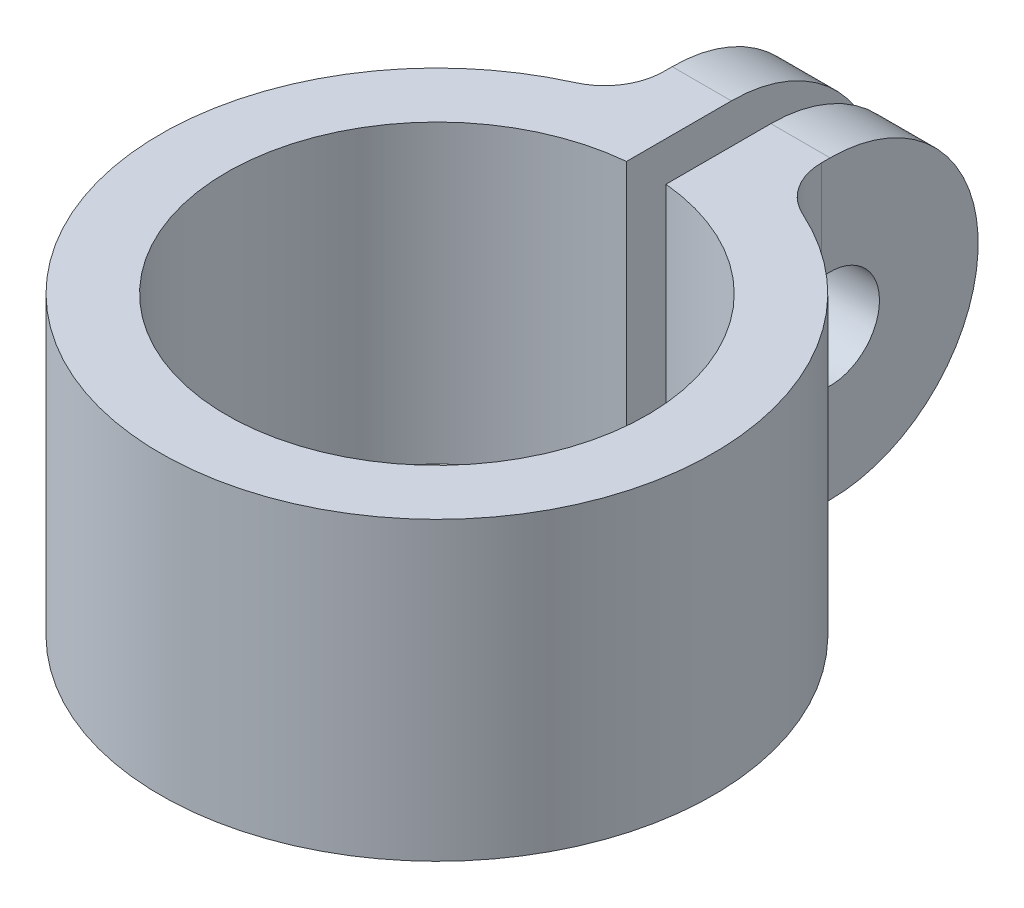
from build123d import *

# Parameters (mm, degrees)
BOSS_EXTRUDE1_DEPTH = 15
FILLET1_RADIUS      = 7.5
FILLET1_LENGTH      = 3
FILLET2_RADIUS      = 7.5
FILLET2_LENGTH      = 3
CUT_EXTRUDE1_REACH  = 35.126
SKETCH2_R           = 2.5


with BuildPart() as part:
    # Sketch1 → Boss-Extrude1 (new body)
    with BuildSketch(Plane(origin=(0, 0, 0), x_dir=(1, 0, 0), z_dir=(0, 1, 0))):
        with BuildLine():
            Line((1, 10.602947703), (1, 23.416407865))
            Line((1, 23.416407865), (4, 23.416407865))
            Line((4, 23.416407865), (4, 15.491933385))
            ThreePointArc((4, 15.491933385), (4.479495849, 13.864954951), (5.764705882, 12.758062788))
            ThreePointArc((5.764705882, 12.758062788), (0, -14), (-5.764705882, 12.758062788))
            ThreePointArc((-5.764705882, 12.758062788), (-4.479495849, 13.864954951), (-4, 15.491933385))
            Line((-4, 15.491933385), (-4, 23.416407865))
            Line((-4, 23.416407865), (-1, 23.416407865))
            Line((-1, 23.416407865), (-1, 10.602947703))
            ThreePointArc((-1, 10.602947703), (0, -10.65), (1, 10.602947703))
        make_face()
    extrude(amount=BOSS_EXTRUDE1_DEPTH)

    # Fillet1: full round fillet: the end face becomes a half cylinder, R = half its width
    fillet1_face = Plane((-2.5, 7.5, -23.416407865), x_dir=(-1, 0, 0), z_dir=(0, 0, -1))  # on the end face: x along it, z out of the body
    fillet1_slab = fillet1_face.offset(-FILLET1_RADIUS / 2) * Box(FILLET1_LENGTH, 2 * FILLET1_RADIUS, FILLET1_RADIUS, mode=Mode.PRIVATE)  # the body's end, R deep
    fillet1_round = Plane((-2.5, 7.5, -15.916407865), x_dir=(0, 0, -1), z_dir=(-1, 0, 0)) * Cylinder(FILLET1_RADIUS, FILLET1_LENGTH, mode=Mode.PRIVATE)  # its axis R under the face
    add(fillet1_slab - fillet1_round, mode=Mode.SUBTRACT)

    # Fillet2: full round fillet: the end face becomes a half cylinder, R = half its width
    fillet2_face = Plane((2.5, 7.5, -23.416407865), x_dir=(1, 0, 0), z_dir=(0, 0, -1))  # on the end face: x along it, z out of the body
    fillet2_slab = fillet2_face.offset(-FILLET2_RADIUS / 2) * Box(FILLET2_LENGTH, 2 * FILLET2_RADIUS, FILLET2_RADIUS, mode=Mode.PRIVATE)  # the body's end, R deep
    fillet2_round = Plane((2.5, 7.5, -15.916407865), x_dir=(0, 0, -1), z_dir=(1, 0, 0)) * Cylinder(FILLET2_RADIUS, FILLET2_LENGTH, mode=Mode.PRIVATE)  # its axis R under the face
    add(fillet2_slab - fillet2_round, mode=Mode.SUBTRACT)

    # Cut-Extrude1: up to this face of the body (flat: up to its plane)
    cut_extrude1_end = Plane(part.part.faces().sort_by_distance((-4, 7.5, -18.87128147))[0])
    # Sketch2 → Cut-Extrude1 (cut, up to the picked face)
    with BuildSketch(Plane(origin=(4, 0, 0), x_dir=(0, 0, -1), z_dir=(1, 0, 0)), mode=Mode.PRIVATE) as cut_extrude1_sk1:
        with Locations(Location((15.916407865, 7.5, 0), (0, 0, 99.775597353))):
            Circle(SKETCH2_R)
    cut_extrude1_tool1 = split(extrude(cut_extrude1_sk1.sketch, amount=-CUT_EXTRUDE1_REACH, mode=Mode.PRIVATE), bisect_by=cut_extrude1_end, keep=Keep.BOTH, mode=Mode.PRIVATE)
    add(cut_extrude1_tool1.solids().sort_by(Axis((4, 7.5, -15.916408), (-1, 0, 0)))[0], mode=Mode.SUBTRACT)


solid = part.part
